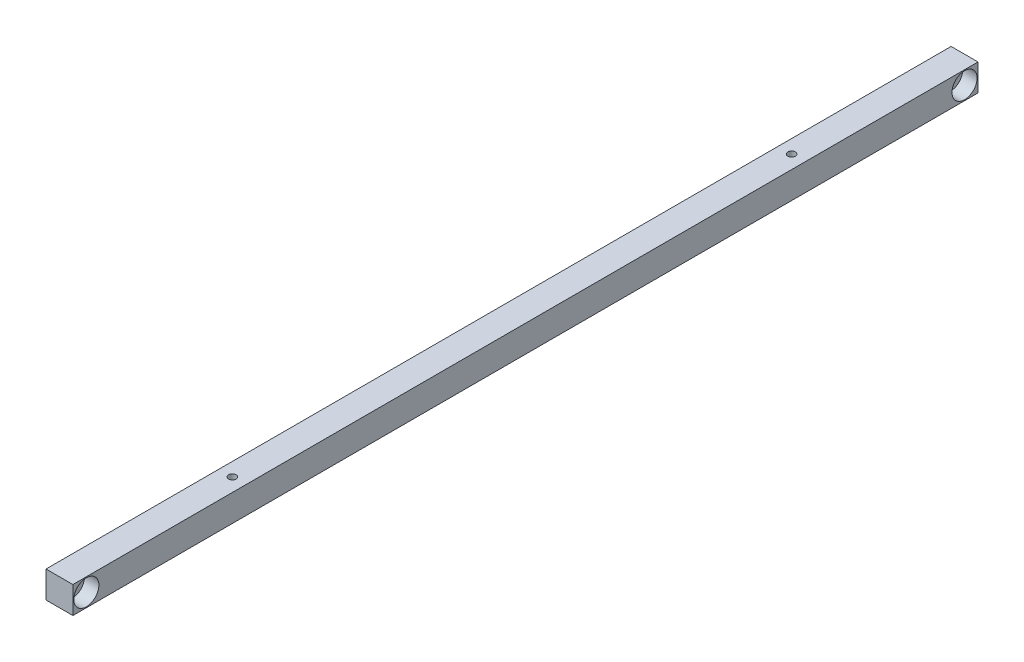
from build123d import *

# Parameters (mm, degrees)
IZIM1_W                     = 15
IZIM1_H                     = 15
Y_KSEKLIK_EKSTR_ZYON1_DEPTH = 252.5
DELIK1_D                    = 8.5
DELIK1_CBORE_D              = 14
DELIK1_CBORE_DEPTH          = 8
M5_DI_LI_DELIK1_D           = 4.2
M5_DI_LI_DELIK1_DEPTH       = 24
M5_DI_LI_DELIK1_CSINK_D     = 5.05
M5_DI_LI_DELIK1_CSINK_ANGLE = 90
M5_DI_LI_DELIK1_TIP         = 1.2618073


with BuildPart() as part:
    # Çizim1 → Yükseklik-Ekstrüzyon1 (new, symmetric)
    with BuildSketch(Plane.XY):
        Rectangle(IZIM1_W, IZIM1_H)
    extrude(amount=Y_KSEKLIK_EKSTR_ZYON1_DEPTH, both=True)

    # Delik1 (through all)
    with Locations(Plane(origin=(7.5, 0, -245), x_dir=(0, 0, 1), z_dir=(1, 0, 0))):
        with Locations((0, 0)):
            delik1 = CounterBoreHole(DELIK1_D / 2, DELIK1_CBORE_D / 2, DELIK1_CBORE_DEPTH)

    # Aynalama1: Delik1 across plane
    add(delik1.mirror(Plane.XY), mode=Mode.SUBTRACT)

    # M5 Dişli Delik1
    with Locations(Plane(origin=(0, -7.5, 0), x_dir=(-1, 0, 0), z_dir=(0, -1, 0))):
        with Locations((0, 155.996395214), (0, -155.996395214)):
            CounterSinkHole(M5_DI_LI_DELIK1_D / 2, M5_DI_LI_DELIK1_CSINK_D / 2, depth=M5_DI_LI_DELIK1_DEPTH, counter_sink_angle=M5_DI_LI_DELIK1_CSINK_ANGLE)
            with Locations((0, 0, -(M5_DI_LI_DELIK1_DEPTH + M5_DI_LI_DELIK1_TIP / 2))):  # 118° drill point
                Cone(0, M5_DI_LI_DELIK1_D / 2, M5_DI_LI_DELIK1_TIP, mode=Mode.SUBTRACT)


solid = part.part
